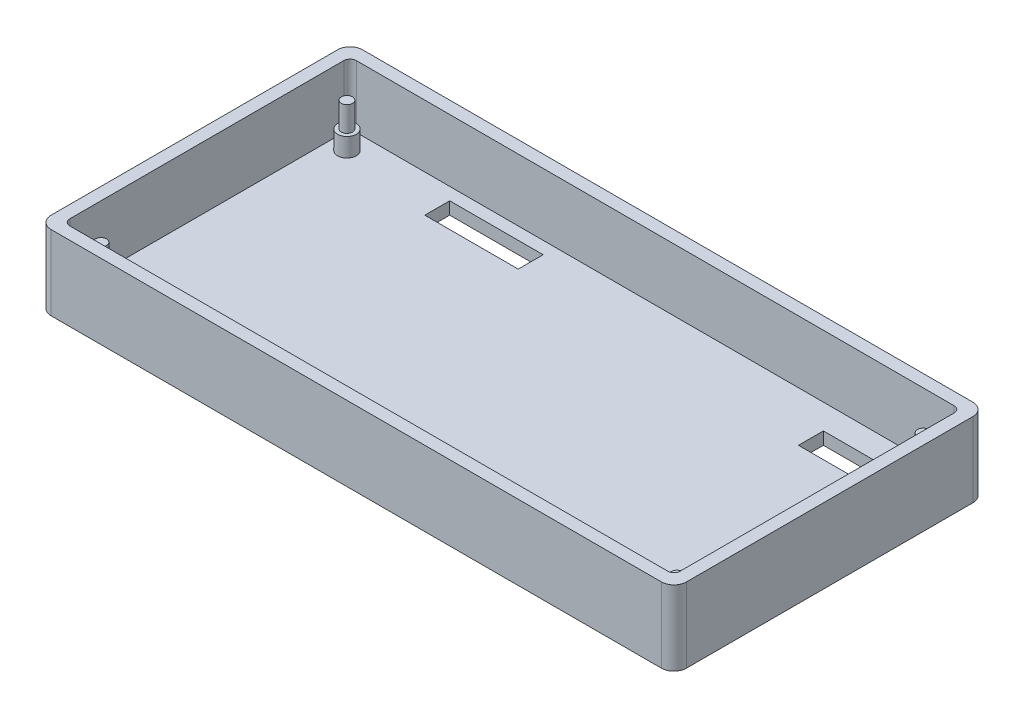
from build123d import *
from OCP.BRepFilletAPI import BRepFilletAPI_MakeFillet

# Parameters (mm, degrees)
SKETCH2_W           = 102
SKETCH2_H           = 50
BOSS_EXTRUDE2_DEPTH = 2
SKETCH1_W           = 102
SKETCH1_H           = 50
SKETCH1_W_2         = 98
SKETCH1_H_2         = 46
BOSS_EXTRUDE1_DEPTH = 12
FILLET1_R1          = 2
FILLET1_R2          = 1
BOSS_EXTRUDE3_DEPTH = 3
SKETCH4_R           = 0.9
BOSS_EXTRUDE4_DEPTH = 4
SKETCH5_W           = 15
SKETCH5_H           = 4
SKETCH5_W_2         = 13
CUT_EXTRUDE1_DEPTH  = 10


with BuildPart() as part:
    # Sketch2 → Boss-Extrude2 (new body)
    with BuildSketch(Plane(origin=(0, 0, 0), x_dir=(1, 0, 0), z_dir=(0, 1, 0))):
        Rectangle(SKETCH2_W, SKETCH2_H)
    extrude(amount=BOSS_EXTRUDE2_DEPTH)

    # Sketch1 → Boss-Extrude1 (add)
    with BuildSketch(Plane(origin=(0, 0, 0), x_dir=(1, 0, 0), z_dir=(0, 1, 0))):
        Rectangle(SKETCH1_W, SKETCH1_H)
        Rectangle(SKETCH1_W_2, SKETCH1_H_2, mode=Mode.SUBTRACT)
    extrude(amount=BOSS_EXTRUDE1_DEPTH)

    # Fillet1: one fillet with a radius per group of edges: ONE call of the kernel's fillet builder (fillet() takes one radius for all edges)
    fillet1_edges_1 = [part.edges().sort_by_distance(p)[0] for p in [
        (51, 6, 25),
        (51, 6, -25),
        (-51, 6, -25),
        (-51, 6, 25),
    ]]
    fillet1_edges_2 = [part.edges().sort_by_distance(p)[0] for p in [
        (-49, 7, 23),
        (49, 7, 23),
        (49, 7, -23),
        (-49, 7, -23),
    ]]
    fillet1 = BRepFilletAPI_MakeFillet(part.part.solid().wrapped)
    for e in fillet1_edges_1:
        fillet1.Add(FILLET1_R1, e.wrapped)
    for e in fillet1_edges_2:
        fillet1.Add(FILLET1_R2, e.wrapped)
    add(Compound.cast(fillet1.Shape()), mode=Mode.REPLACE)

    # Sketch3 → Boss-Extrude3 (add)
    with BuildSketch(Plane(origin=(0, 2, 0), x_dir=(1, 0, 0), z_dir=(0, 1, 0))):
        with BuildLine():
            ThreePointArc((-44.75, 19.75), (-47.310660172, 20.810660172), (-46.25, 18.25))
            Line((-46.25, 18.25), (-46.25, 19.75))
            Line((-46.25, 19.75), (-44.75, 19.75))
        make_face()
        with BuildLine():
            Line((-46.25, 19.75), (-46.25, 18.25))
            ThreePointArc((-46.25, 18.25), (-45.189339828, 18.689339828), (-44.75, 19.75))
            Line((-44.75, 19.75), (-46.25, 19.75))
        make_face()
        with BuildLine():
            Line((-46.25, -18.25), (-46.25, -19.75))
            Line((-46.25, -19.75), (-44.75, -19.75))
            ThreePointArc((-44.75, -19.75), (-45.189339828, -18.689339828), (-46.25, -18.25))
        make_face()
        with BuildLine():
            Line((-44.75, -19.75), (-46.25, -19.75))
            Line((-46.25, -19.75), (-46.25, -18.25))
            ThreePointArc((-46.25, -18.25), (-47.310660172, -20.810660172), (-44.75, -19.75))
        make_face()
        with BuildLine():
            ThreePointArc((46.25, -18.25), (45.189339828, -18.689339828), (44.75, -19.75))
            Line((44.75, -19.75), (46.25, -19.75))
            Line((46.25, -19.75), (46.25, -18.25))
        make_face()
        with BuildLine():
            Line((46.25, -19.75), (44.75, -19.75))
            ThreePointArc((44.75, -19.75), (46.25, -21.25), (47.75, -19.75))
            ThreePointArc((47.75, -19.75), (47.310660172, -18.689339828), (46.25, -18.25))
            Line((46.25, -18.25), (46.25, -19.75))
        make_face()
        with BuildLine():
            ThreePointArc((44.75, 19.75), (45.189339828, 18.689339828), (46.25, 18.25))
            Line((46.25, 18.25), (46.25, 19.75))
            Line((46.25, 19.75), (44.75, 19.75))
        make_face()
        with BuildLine():
            Line((46.25, 19.75), (46.25, 18.25))
            ThreePointArc((46.25, 18.25), (47.310660172, 18.689339828), (47.75, 19.75))
            ThreePointArc((47.75, 19.75), (46.25, 21.25), (44.75, 19.75))
            Line((44.75, 19.75), (46.25, 19.75))
        make_face()
    extrude(amount=BOSS_EXTRUDE3_DEPTH)

    # Sketch4 → Boss-Extrude4 (add)
    with BuildSketch(Plane(origin=(0, 5, 0), x_dir=(1, 0, 0), z_dir=(0, 1, 0))):
        with Locations(Location((-46.25, 19.75, 0), (0, 0, 270))):
            Circle(SKETCH4_R)
        with Locations(Location((-46.25, -19.75, 0), (0, 0, 270))):
            Circle(SKETCH4_R)
        with Locations(Location((46.25, 19.75, 0), (0, 0, 270))):
            Circle(SKETCH4_R)
        with Locations(Location((46.25, -19.75, 0), (0, 0, 270))):
            Circle(SKETCH4_R)
    extrude(amount=BOSS_EXTRUDE4_DEPTH)

    # Sketch5 → Cut-Extrude1 (cut)
    with BuildSketch(Plane(origin=(0, 2, 0), x_dir=(1, 0, 0), z_dir=(0, 1, 0))):
        with Locations((-23.5, 19)):
            Rectangle(SKETCH5_W, SKETCH5_H)
        with Locations((37.5, 17)):
            Rectangle(SKETCH5_W_2, SKETCH5_H)
    extrude(amount=-CUT_EXTRUDE1_DEPTH, mode=Mode.SUBTRACT)


solid = part.part
